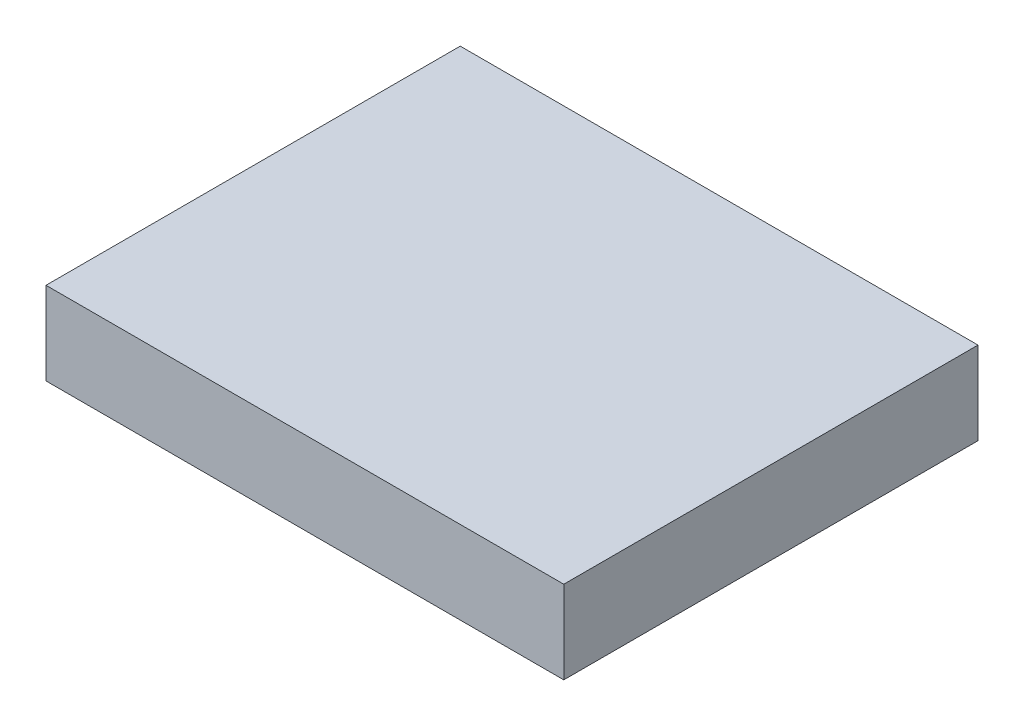
from build123d import *

# Parameters (mm, degrees)
SKETCH1_W           = 25
SKETCH1_H           = 20
BOSS_EXTRUDE1_DEPTH = 4


with BuildPart() as part:
    # Sketch1 → Boss-Extrude1 (new body)
    with BuildSketch(Plane(origin=(0, 0, 0), x_dir=(1, 0, 0), z_dir=(0, 1, 0))):
        Rectangle(SKETCH1_W, SKETCH1_H)
    extrude(amount=BOSS_EXTRUDE1_DEPTH)


solid = part.part
